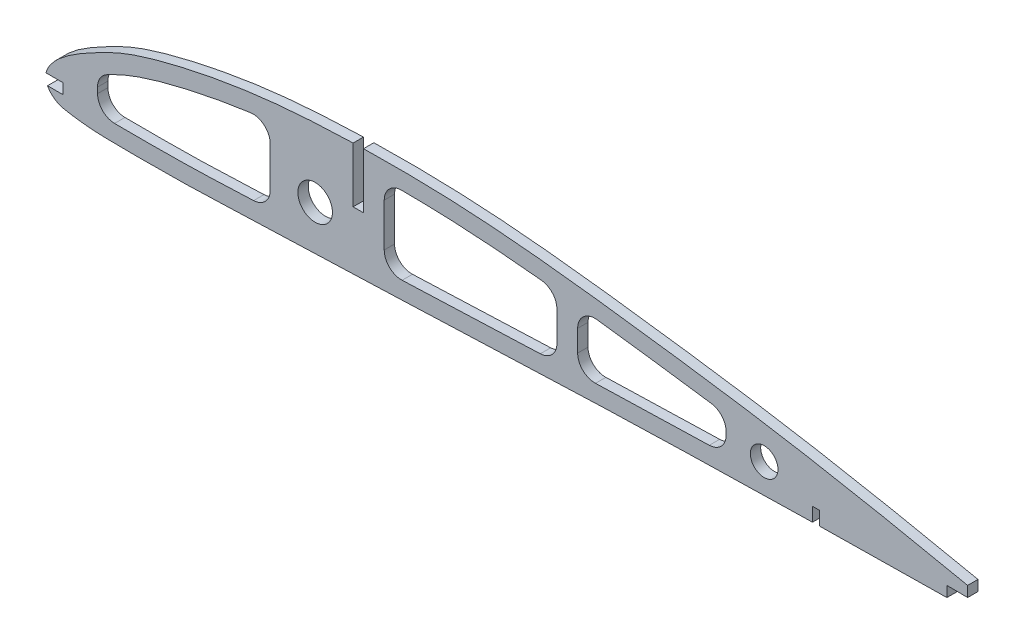
from build123d import *

# Parameters (mm, degrees)
SKETCH_1_R          = 5
SKETCH_1_R_2        = 4
EXTRUDE_1_DEPTH     = 3
CUT_EXTRUDE_2_DEPTH = 291.422386836


with BuildPart() as part:
    # 草图1 → 凸台-拉伸1 (new body)
    with BuildSketch(Plane.XY):
        with BuildLine():
            Line((90, 12.3715), (90, 28.372426217))
            add(Edge.make_bspline(
                [(90, 28.372426217), (89.259446982, 28.350928743), (82.363996343, 28.13322439), (72.403347361, 27.586524792), (60.185862052, 26.226268085), (51.080991088, 24.79810862), (42.033943524, 23.000087944), (34.581994337, 21.174922903), (28.697351661, 19.44563851), (24.361981086, 17.983441115), (20.174828998, 16.207949367), (16.078941989, 14.139912989), (12.040296713, 11.946766626), (8.14011433, 9.56039573), (5.153679337, 7.316395724), (3.100060439, 5.200618052), (1.813825976, 3.470730924), (1.237398467, 2.180506339), (1.085380705, 1.529058937), (1.078882286, 1.5)],
                knots=[0.345773533, 0.345773533, 0.345773533, 0.345773533, 0.349398211, 0.379527288, 0.394591827, 0.409656366, 0.424720905, 0.439785444, 0.447317713, 0.454849983, 0.462382252, 0.469914522, 0.477446791, 0.484979061, 0.49251133, 0.496277465, 0.5000436, 0.503809734, 0.503985678, 0.503985678, 0.503985678, 0.503985678], degree=3))
            Line((1.078882286, 1.5), (6, 1.5))
            Line((6, 1.5), (6, -1.5))
            Line((6, -1.5), (1.522379628, -1.5))
            add(Edge.make_bspline(
                [(1.522379628, -1.5), (1.617903461, -1.678770523), (2.068186491, -2.42442122), (3.143139608, -3.601090845), (4.854253, -4.619355756), (6.927567017, -5.105597911), (9.209034621, -5.454839075), (12.219971865, -5.84289763), (16.020132359, -6.14266222), (20.609524976, -6.2611368), (25.231457517, -6.286948592), (31.397380169, -6.280305851), (39.107274969, -6.240736398), (48.336813051, -6.022096429), (57.579935967, -5.612990736), (66.840654471, -5.242934226), (76.096556555, -4.921715721), (88.435998513, -4.515955408), (103.853120896, -3.973102953), (122.354625015, -3.248110744), (140.857835973, -2.495489966), (159.368527813, -1.804089638), (177.884173919, -1.222493213), (196.4033921, -0.774877257), (211.439290174, -0.454334834), (220.305576898, -0.265987383), (223, -0.210849605)],
                knots=[0.510182255, 0.510182255, 0.510182255, 0.510182255, 0.511342004, 0.515108139, 0.518874273, 0.522640408, 0.526406543, 0.530172677, 0.537704947, 0.545237216, 0.552769486, 0.560301755, 0.575366294, 0.590430833, 0.605495372, 0.620559911, 0.63562445, 0.650688989, 0.680818067, 0.710947144, 0.741076222, 0.7712053, 0.801334378, 0.831463456, 0.861592533, 0.874744372, 0.874744372, 0.874744372, 0.874744372], degree=3))
            Line((223, -0.210849605), (223, 3.788737263))
            Line((223, 3.788737263), (225, 3.788737263))
            Line((225, 3.788737263), (225, -0.170338801))
            add(Edge.make_bspline(
                [(225, -0.170338801), (227.811595191, -0.114017747), (236.796798206, 0.056910764), (251.961175933, 0.256656825), (270.471854229, 0.429163033), (282.824771355, 0.587434741), (289, 0.610062865)],
                knots=[0.877998396, 0.877998396, 0.877998396, 0.877998396, 0.891721611, 0.921850689, 0.951979767, 0.982108845, 0.982108845, 0.982108845, 0.982108845], degree=3))
            Line((289, 0.610062865), (289, 1.816246039))
            add(Edge.make_bspline(
                [(289, 1.816246039), (276.957314444, 4.502285023), (258.861554155, 8.397620333), (234.648247971, 13.152786595), (216.448478593, 16.478914183), (198.182873559, 19.371550405), (179.850571346, 21.924148488), (161.503162682, 24.358614825), (143.127892269, 26.473190985), (124.712239059, 28.043780086), (107.994173705, 28.616385423), (97.416270032, 28.546670082), (93, 28.44913561)],
                knots=[0.017978355, 0.017978355, 0.017978355, 0.017978355, 0.07823651, 0.108365588, 0.138494666, 0.168623744, 0.198752821, 0.228881899, 0.259010977, 0.289140055, 0.319269133, 0.340879606, 0.340879606, 0.340879606, 0.340879606], degree=3))
            Line((93, 28.44913561), (93, 12.3715))
            Line((93, 12.3715), (90, 12.3715))
        make_face()
        with Locations((79, 8)):
            Circle(SKETCH_1_R, mode=Mode.SUBTRACT)
        with Locations((209, 8)):
            Circle(SKETCH_1_R_2, mode=Mode.SUBTRACT)
    extrude(amount=EXTRUDE_1_DEPTH)

    # 草图3 → 切除-拉伸2 (cut, through all)
    with BuildSketch(Plane.XY):
        Polygon((261.913052859, 3.412186808), (261.913052859, 0.349901395), (296.913052859, 0.349901395), (267.913052859, 6.412186808), (267.913052859, 3.362186808), align=None)
        with BuildLine():
            Line((16, 5.402967421), (16, 3.749585631))
            ThreePointArc((16, 3.749585631), (17.438635496, 0.240072435), (20.926673148, -1.249876658))
            add(Edge.make_bspline(
                [(20.926673148, -1.249876658), (21.809693827, -1.262827876), (22.70041751, -1.270722289), (24.744752026, -1.282014543), (25.903390676, -1.283802206), (29.38108188, -1.283541675), (31.709604831, -1.277171959), (36.343989553, -1.248263334), (38.652190318, -1.223511787), (43.261210505, -1.138923387), (45.563329713, -1.080117385), (50.168153725, -0.92677743), (52.481550313, -0.831144642), (56.932408226, -0.642663317), (59.067384966, -0.552312083), (61.20153145, -0.466222597)],
                knots=[0.097228806, 0.097228806, 0.097228806, 0.097228806, 0.109375, 0.109375, 0.125, 0.125, 0.15625, 0.15625, 0.1875, 0.1875, 0.21875, 0.21875, 0.25, 0.25, 0.27850067, 0.27850067, 0.27850067, 0.27850067], degree=3))
            ThreePointArc((61.20153145, -0.466222597), (64.606082171, 1.066165303), (66, 4.529714259))
            Line((66, 4.529714259), (66, 16.175207171))
            ThreePointArc((66, 16.175207171), (64.287676463, 19.942325894), (60.32352661, 21.129234195))
            add(Edge.make_bspline(
                [(60.32352661, 21.129234195), (59.143282742, 20.968071656), (57.964431768, 20.796736398), (53.109249428, 20.046773379), (49.445857595, 19.384253181), (42.158673028, 17.868714577), (38.533379611, 17.019586343), (33.148990447, 15.546220745), (31.362942012, 15.022439399), (27.821005995, 13.880218625), (26.067238608, 13.253271835), (22.635818059, 11.812670552), (20.957942753, 11.004847704), (19.099592195, 10.049689097), (18.896441621, 9.944700093), (18.693547477, 9.839213217)],
                knots=[0.029920383, 0.029920383, 0.029920383, 0.029920383, 0.033494004, 0.033494004, 0.044658672, 0.044658672, 0.05582334, 0.05582334, 0.061405674, 0.061405674, 0.066988008, 0.066988008, 0.072570342, 0.072570342, 0.073256353, 0.073256353, 0.073256353, 0.073256353], degree=3))
            ThreePointArc((18.693547477, 9.839213217), (16.726110517, 7.997937304), (16, 5.402967421))
        make_face()
        with BuildLine():
            Line((99, 18.545958183), (99, 6.051698891))
            ThreePointArc((99, 6.051698891), (100.530987404, 2.450872374), (104.186380643, 1.055173873))
            add(Edge.make_bspline(
                [(104.186380643, 1.055173873), (106.39458867, 1.137544567), (108.602901821, 1.221357381), (120.131865001, 1.665786726), (129.456324286, 2.050051394), (140.592579239, 2.48797418), (142.3918285, 2.557905459), (144.191396926, 2.626842357)],
                knots=[0.470377348, 0.470377348, 0.470377348, 0.470377348, 0.5, 0.5, 0.625, 0.625, 0.649081852, 0.649081852, 0.649081852, 0.649081852], degree=3))
            ThreePointArc((144.191396926, 2.626842357), (147.602567462, 4.155973144), (149, 7.623177736))
            Line((149, 7.623177736), (149, 16.241622969))
            ThreePointArc((149, 16.241622969), (147.712532938, 19.59081678), (144.513160327, 21.215219904))
            add(Edge.make_bspline(
                [(144.513160327, 21.215219904), (143.652145828, 21.304056714), (142.791222193, 21.391146352), (137.856440927, 21.879784463), (133.787425472, 22.240923522), (125.659256001, 22.840362063), (121.601588339, 23.075546461), (113.037568805, 23.424275072), (108.53263967, 23.523953165), (104.024339014, 23.545898944)],
                knots=[0.736793621, 0.736793621, 0.736793621, 0.736793621, 0.75, 0.75, 0.8125, 0.8125, 0.875, 0.875, 0.944193059, 0.944193059, 0.944193059, 0.944193059], degree=3))
            ThreePointArc((104.024339014, 23.545898944), (100.473081733, 22.090086783), (99, 18.545958183))
        make_face()
        with BuildLine():
            Line((155, 14.41455393), (155, 8.204846233))
            ThreePointArc((155, 8.204846233), (156.525241738, 4.609563904), (160.17042201, 3.207751443))
            add(Edge.make_bspline(
                [(160.17042201, 3.207751443), (162.389721662, 3.283438922), (164.609319497, 3.356780918), (171.504636491, 3.576232826), (176.18199895, 3.713351663), (184.945921303, 3.946800138), (189.03214497, 4.046860263), (193.116453453, 4.14201244)],
                knots=[0.720326449, 0.720326449, 0.720326449, 0.720326449, 0.75, 0.75, 0.8125, 0.8125, 0.867133534, 0.867133534, 0.867133534, 0.867133534], degree=3))
            ThreePointArc((193.116453453, 4.14201244), (196.576469437, 5.64653729), (198, 9.140656115))
            Line((198, 9.140656115), (198, 9.967295711))
            ThreePointArc((198, 9.967295711), (196.781019979, 13.238975389), (193.718444833, 14.915410202))
            add(Edge.make_bspline(
                [(193.718444833, 14.915410202), (192.779013077, 15.051811632), (191.839123333, 15.187073825), (186.824226186, 15.902901834), (182.740892869, 16.465870736), (174.565909682, 17.575800313), (170.481299177, 18.120965891), (164.469973656, 18.894543341), (162.541485429, 19.138417507), (160.613475955, 19.376775938)],
                knots=[0.485575284, 0.485575284, 0.485575284, 0.485575284, 0.5, 0.5, 0.5625, 0.5625, 0.625, 0.625, 0.654532252, 0.654532252, 0.654532252, 0.654532252], degree=3))
            ThreePointArc((160.613475955, 19.376775938), (156.688458046, 18.160710613), (155, 14.41455393))
        make_face()
    extrude(amount=CUT_EXTRUDE_2_DEPTH, mode=Mode.SUBTRACT)


solid = part.part
